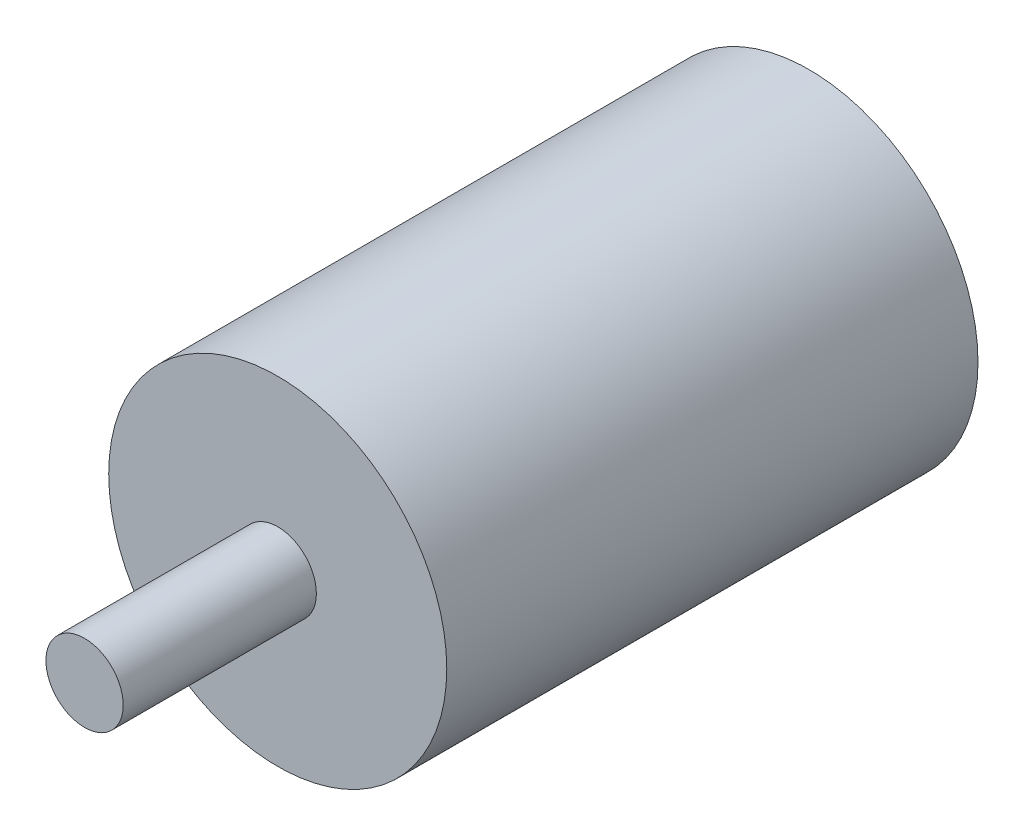
from build123d import *

# Parameters (mm, degrees)
SKETCH_1_R      = 17.5
EXTRUDE_1_DEPTH = 55
SKETCH_2_R      = 4
EXTRUDE_2_DEPTH = 20


with BuildPart() as part:
    # 草图1 → 凸台-拉伸1 (new body)
    with BuildSketch(Plane.XY):
        Circle(SKETCH_1_R)
    extrude(amount=EXTRUDE_1_DEPTH)

    # 草图2 → 凸台-拉伸2 (add)
    with BuildSketch(Plane.XY.offset(55)):
        Circle(SKETCH_2_R)
    extrude(amount=EXTRUDE_2_DEPTH)


solid = part.part
